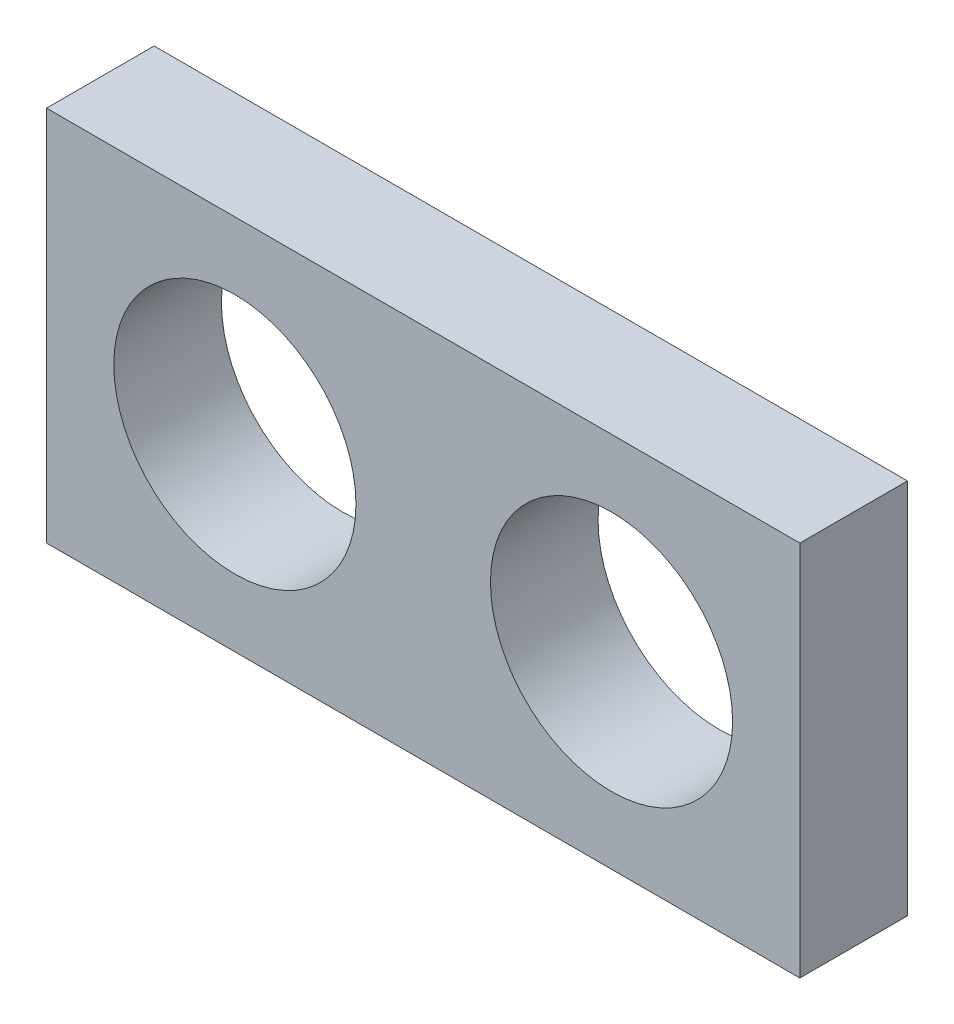
from build123d import *

# Parameters (mm, degrees)
ESQUISSE1_W        = 14
ESQUISSE1_H        = 7
ESQUISSE1_R        = 2.25
BOSS_EXTRU_1_DEPTH = 2


with BuildPart() as part:
    # Esquisse1 → Boss.-Extru.1 (new body)
    with BuildSketch(Plane.XY):
        with Locations((8.754909123, 0.160284443)):
            Rectangle(ESQUISSE1_W, ESQUISSE1_H)
        with Locations((5.254909123, 0.160284443)):
            Circle(ESQUISSE1_R, mode=Mode.SUBTRACT)
        with Locations((12.254909123, 0.160284443)):
            Circle(ESQUISSE1_R, mode=Mode.SUBTRACT)
    extrude(amount=BOSS_EXTRU_1_DEPTH)


solid = part.part
